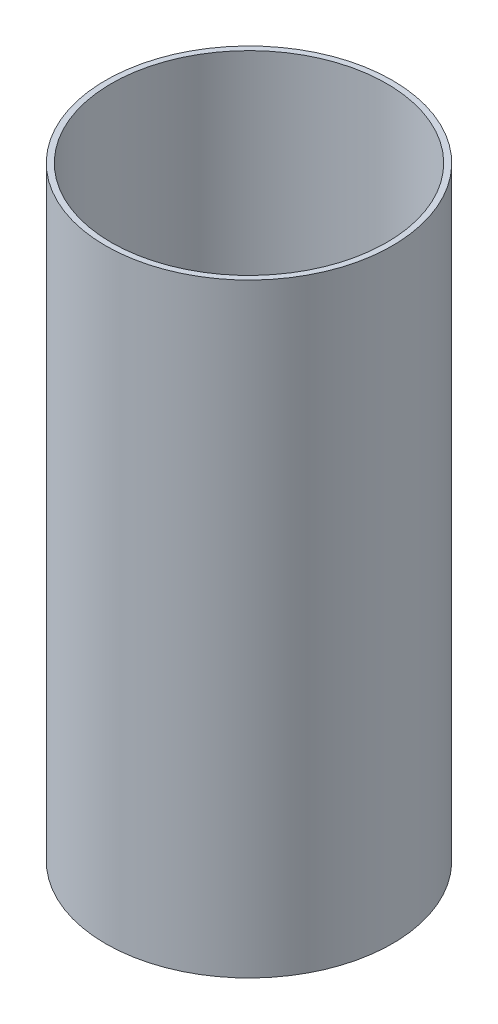
from build123d import *

# Parameters (mm, degrees)
SKETCH1_R           = 37.95
SKETCH1_R_2         = 36.45
BOSS_EXTRUDE1_DEPTH = 160


with BuildPart() as part:
    # Sketch1 → Boss-Extrude1 (new body)
    with BuildSketch(Plane(origin=(0, 0, 0), x_dir=(1, 0, 0), z_dir=(0, 1, 0))):
        with Locations(Location((0, 0, 0), (0, 0, 270))):
            Circle(SKETCH1_R)
        with Locations(Location((0, 0, 0), (0, 0, 270))):
            Circle(SKETCH1_R_2, mode=Mode.SUBTRACT)
    extrude(amount=BOSS_EXTRUDE1_DEPTH)


solid = part.part
